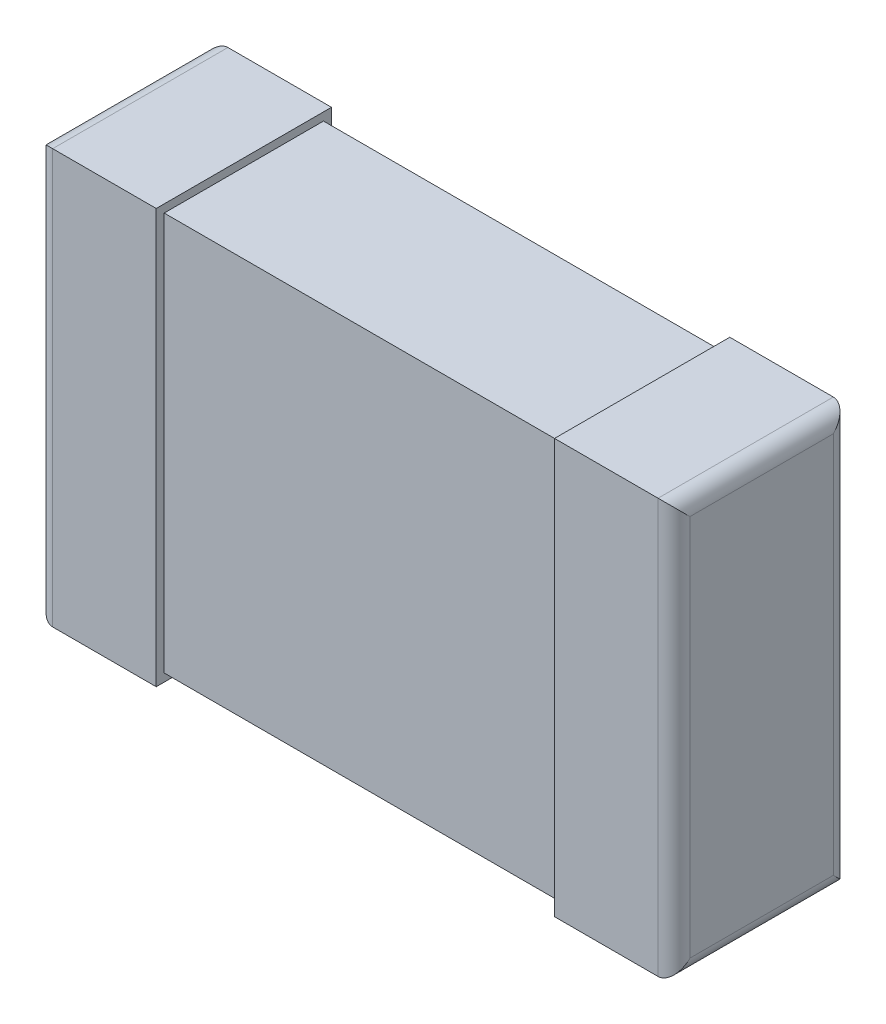
from build123d import *

# Parameters (mm, degrees)
SKETCH1_W           = 2.032
SKETCH1_H           = 1.27
BOSS_EXTRUDE1_DEPTH = 0.508
SKETCH2_W           = 0.5588
SKETCH2_H           = 1.3208
BOSS_EXTRUDE2_DEPTH = 0.381
FILLET1_R           = 0.0508


with BuildPart() as part:
    # Sketch1 → Boss-Extrude1 (new body)
    with BuildSketch(Plane.XY):
        with Locations((1.016, 0.635)):
            Rectangle(SKETCH1_W, SKETCH1_H)
    extrude(amount=BOSS_EXTRUDE1_DEPTH)

    # Sketch2 → Boss-Extrude2 (add)
    with BuildSketch(Plane.ZY):
        with Locations((0.254, 0.635)):
            Rectangle(SKETCH2_W, SKETCH2_H)
    boss_extrude2 = extrude(amount=-BOSS_EXTRUDE2_DEPTH)

    # Mirror1: Boss-Extrude2 across plane
    add(boss_extrude2.mirror(Plane.ZY.offset(-1.016)))

    # Fillet1
    fillet1_edges = [part.edges().sort_by_distance(p)[0] for p in [
        (0, 1.2954, 0.254),
        (0, 0.635, -0.0254),
        (0, -0.0254, 0.254),
        (0, 0.635, 0.5334),
        (2.032, 1.2954, 0.254),
        (2.032, 0.635, -0.0254),
        (2.032, -0.0254, 0.254),
        (2.032, 0.635, 0.5334),
    ]]
    fillet(fillet1_edges, radius=FILLET1_R)


solid = part.part
